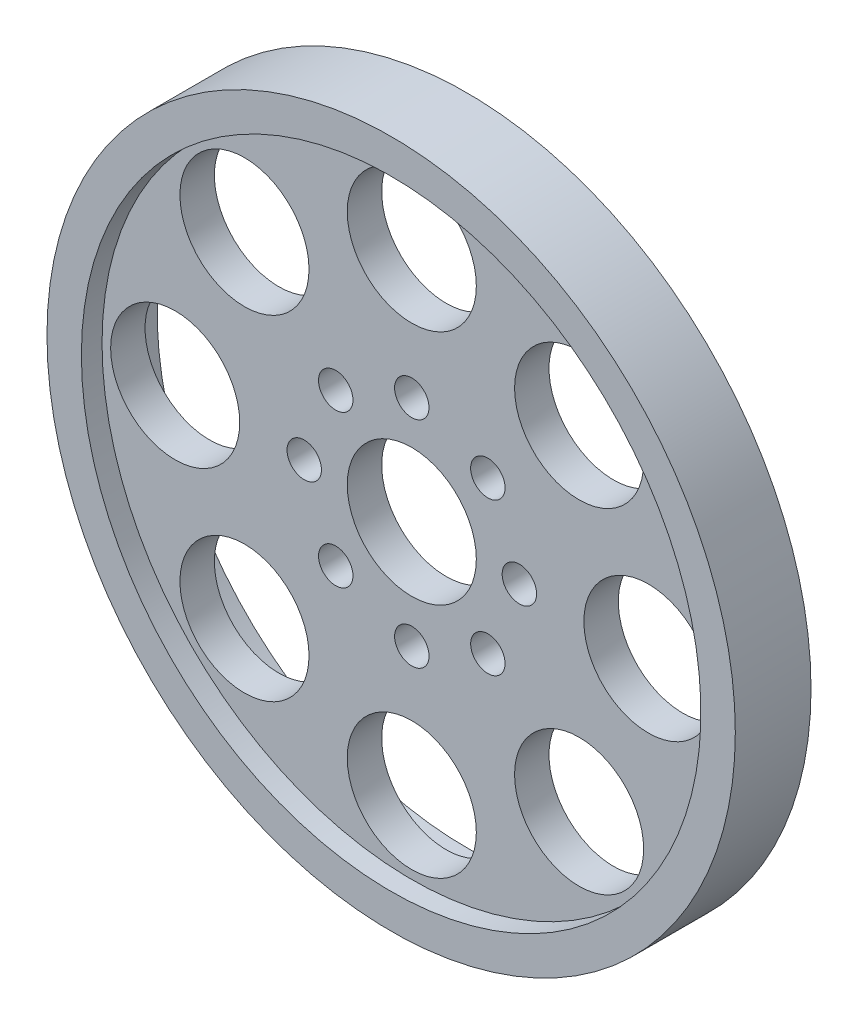
from build123d import *

# Parameters (mm, degrees)
SKETCH1_R               = 25.4
BOSS_EXTRUDE1_DEPTH     = 2.794
SKETCH2_R               = 4.7625
SKETCH2_R_2             = 1.27
CUT_EXTRUDE1_DEPTH      = 37.353070627
CUT_EXTRUDE2_START      = -1.27
SKETCH3_R               = 22.86
CUT_EXTRUDE2_DEPTH      = 1.651
CUT_EXTRUDE3_DEPTH      = 37.029521729
CUT_EXTRUDE3_DEPTH_BACK = 37.029521729
SKETCH4_R               = 4.7625


with BuildPart() as part:
    # Sketch1 → Boss-Extrude1 (new, symmetric)
    with BuildSketch(Plane.XY):
        Circle(SKETCH1_R)
    extrude(amount=BOSS_EXTRUDE1_DEPTH, both=True)

    # Sketch2 → Cut-Extrude1 (cut, through all)
    with BuildSketch(Plane.XY.offset(2.794)):
        Circle(SKETCH2_R)
        with Locations((0, 7.9375)):
            Circle(SKETCH2_R_2)
        with Locations((5.612952969, 5.613367182)):
            Circle(SKETCH2_R_2)
        with Locations((7.9385, 0.001)):
            Circle(SKETCH2_R_2)
        with Locations((5.614367182, -5.611952969)):
            Circle(SKETCH2_R_2)
        with Locations((0.002, -7.9375)):
            Circle(SKETCH2_R_2)
        with Locations((-5.610952969, -5.613367182)):
            Circle(SKETCH2_R_2)
        with Locations((-7.9365, -0.001)):
            Circle(SKETCH2_R_2)
        with Locations((-5.612367182, 5.611952969)):
            Circle(SKETCH2_R_2)
    extrude(amount=-CUT_EXTRUDE1_DEPTH, mode=Mode.SUBTRACT)

    # Sketch3 → Cut-Extrude2 (cut)
    with BuildSketch(Plane.XY.offset(CUT_EXTRUDE2_START)):
        Circle(SKETCH3_R)
    cut_extrude2 = extrude(amount=-CUT_EXTRUDE2_DEPTH, mode=Mode.SUBTRACT)

    # Mirror1: Cut-Extrude2 across plane
    add(cut_extrude2.mirror(Plane.XY), mode=Mode.SUBTRACT)

    # Sketch4 → Cut-Extrude3 (cut, two sides: drawn at the far end of the back side and taken through both)
    with BuildSketch(Plane.XY.offset(-CUT_EXTRUDE3_DEPTH_BACK)):
        with Locations((0, 17.4625)):
            Circle(SKETCH4_R)
        with Locations((12.347852166, 12.347852166)):
            Circle(SKETCH4_R)
        with Locations((17.4625, 0)):
            Circle(SKETCH4_R)
        with Locations((12.347852166, -12.347852166)):
            Circle(SKETCH4_R)
        with Locations((0, -17.4625)):
            Circle(SKETCH4_R)
        with Locations((-12.347852166, -12.347852166)):
            Circle(SKETCH4_R)
        with Locations((-17.4625, 0)):
            Circle(SKETCH4_R)
        with Locations((-12.347852166, 12.347852166)):
            Circle(SKETCH4_R)
    extrude(amount=CUT_EXTRUDE3_DEPTH + CUT_EXTRUDE3_DEPTH_BACK, mode=Mode.SUBTRACT)


solid = part.part
